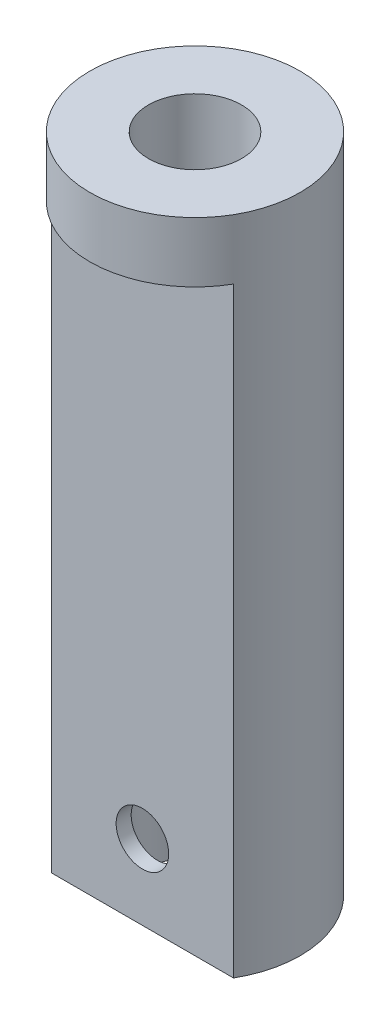
from build123d import *

# Parameters (mm, degrees)
Y_KSEKLIK_EKSTR_ZYON1_DEPTH = 30
IZIM2_R                     = 7
IZIM2_R_2                   = 3.1
Y_KSEKLIK_EKSTR_ZYON2_DEPTH = 4
Y_KSEKLIK_EKSTR_ZYON3_START = 10
Y_KSEKLIK_EKSTR_ZYON3_DEPTH = 10
KES_EKSTR_ZYON2_START       = -10
KES_EKSTR_ZYON2_DEPTH       = 10
IZIM7_R                     = 1.75
KES_EKSTR_ZYON3_DEPTH       = 12


with BuildPart() as part:
    # Çizim1 → Yükseklik-Ekstrüzyon1 (new body)
    with BuildSketch(Plane(origin=(0, 0, 0), x_dir=(1, 0, 0), z_dir=(0, 1, 0))):
        with BuildLine():
            Line((-6.062177826, -3.5), (6.062177826, -3.5))
            ThreePointArc((6.062177826, -3.5), (0, 7), (-6.062177826, -3.5))
        make_face()
        with BuildLine():
            Line((-1.833030278, -2.5), (1.833030278, -2.5))
            ThreePointArc((1.833030278, -2.5), (0, 3.1), (-1.833030278, -2.5))
        make_face(mode=Mode.SUBTRACT)
    extrude(amount=Y_KSEKLIK_EKSTR_ZYON1_DEPTH)

    # Çizim2 → Yükseklik-Ekstrüzyon2 (add)
    with BuildSketch(Plane(origin=(0, 30, 0), x_dir=(1, 0, 0), z_dir=(0, 1, 0))):
        with Locations(Location((0, 0, 0), (0, 0, 210))):
            Circle(IZIM2_R)
        with Locations(Location((0, 0, 0), (0, 0, 233.750679117))):
            Circle(IZIM2_R_2, mode=Mode.SUBTRACT)
    extrude(amount=Y_KSEKLIK_EKSTR_ZYON2_DEPTH)

    # Çizim3 → Yükseklik-Ekstrüzyon3 (add)
    with BuildSketch(Plane.XZ.offset(Y_KSEKLIK_EKSTR_ZYON3_START)):
        with BuildLine():
            Line((-6.062177826, 3.5), (6.062177826, 3.5))
            ThreePointArc((6.062177826, 3.5), (0, -7), (-6.062177826, 3.5))
        make_face()
    extrude(amount=-Y_KSEKLIK_EKSTR_ZYON3_DEPTH)

    # Çizim5 → Kes-Ekstrüzyon2 (cut)
    with BuildSketch(Plane(origin=(0, 0, 0), x_dir=(1, 0, 0), z_dir=(0, 1, 0)).offset(KES_EKSTR_ZYON2_START)):
        with BuildLine():
            Line((-1.833030278, -2.5), (1.833030278, -2.5))
            ThreePointArc((1.833030278, -2.5), (0, 3.1), (-1.833030278, -2.5))
        make_face()
    extrude(amount=KES_EKSTR_ZYON2_DEPTH, mode=Mode.SUBTRACT)

    # Çizim7 → Kes-Ekstrüzyon3 (cut)
    with BuildSketch(Plane.XY.offset(3.5)):
        with Locations((0, -5)):
            Circle(IZIM7_R)
    extrude(amount=-KES_EKSTR_ZYON3_DEPTH, mode=Mode.SUBTRACT)


solid = part.part
